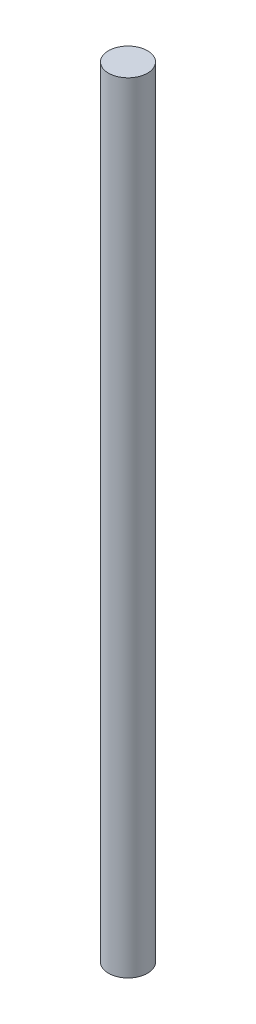
from build123d import *

# Parameters (mm, degrees)
SKETCH1_R           = 1.27
BOSS_EXTRUDE1_DEPTH = 25.4


with BuildPart() as part:
    # Sketch1 → Boss-Extrude1 (new, symmetric)
    with BuildSketch(Plane(origin=(0, 0, 0), x_dir=(1, 0, 0), z_dir=(0, 1, 0))):
        with Locations(Location((0, 0, 0), (0, 0, 270))):
            Circle(SKETCH1_R)
    extrude(amount=BOSS_EXTRUDE1_DEPTH, both=True)


solid = part.part
